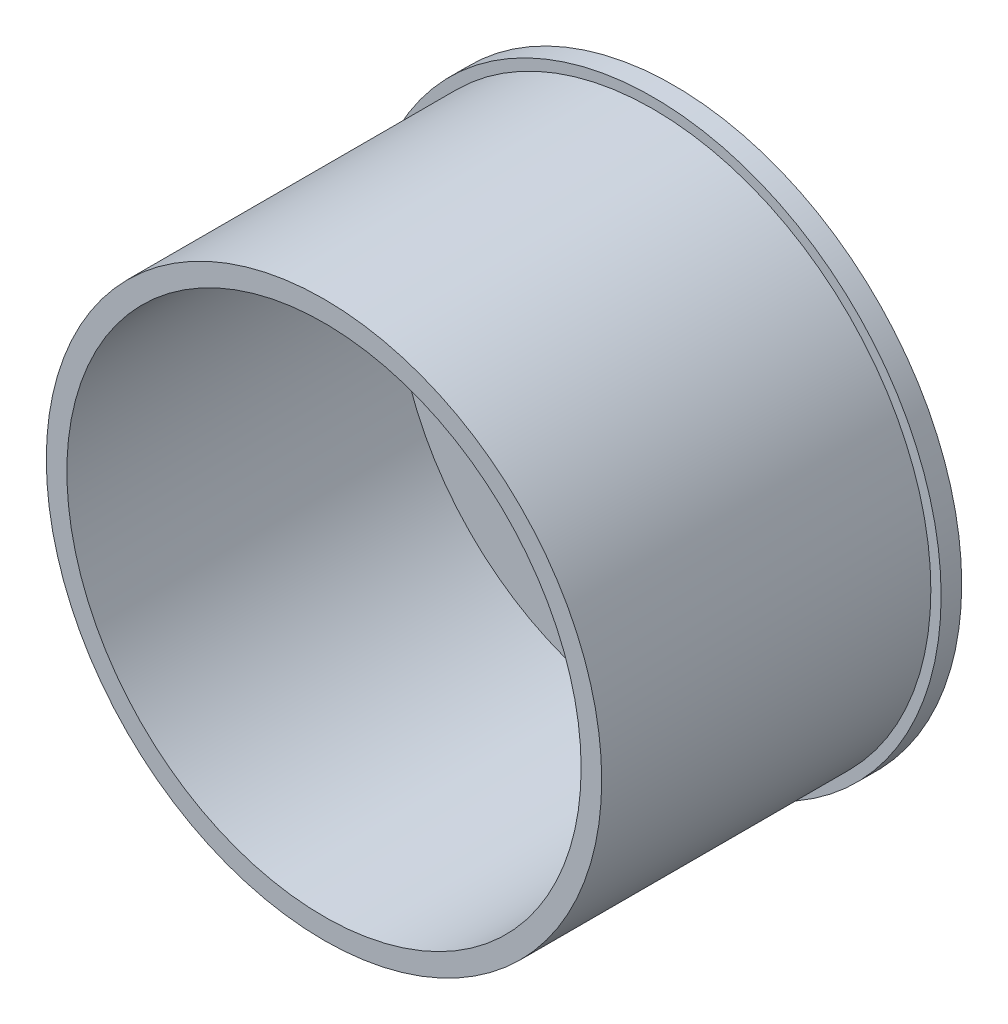
from build123d import *

# Parameters (mm, degrees)
SKETCH1_R           = 88.9
BOSS_EXTRUDE1_DEPTH = 6.35
SKETCH2_R           = 3.302
CUT_EXTRUDE1_DEPTH  = 126.88384527
SKETCH3_R           = 85.725
SKETCH3_R_2         = 79.375
BOSS_EXTRUDE2_DEPTH = 101.6


with BuildPart() as part:
    # Sketch1 → Boss-Extrude1 (new body)
    with BuildSketch(Plane.XY):
        Circle(SKETCH1_R)
    extrude(amount=BOSS_EXTRUDE1_DEPTH)

    # Sketch2 → Cut-Extrude1 (cut, through all)
    with BuildSketch(Plane(origin=(0, 0, 0), x_dir=(-1, 0, 0), z_dir=(0, 0, -1))):
        with Locations((19.05, 0)):
            Circle(SKETCH2_R)
        with BuildLine():
            Line((3.081986422, 3.266652236), (3.265367316, -3.083347764))
            ThreePointArc((3.265367316, -3.083347764), (0.183342684, -6.348676869), (-3.081986422, -3.266652236))
            Line((-3.081986422, -3.266652236), (-3.265367316, 3.083347764))
            ThreePointArc((-3.265367316, 3.083347764), (-0.183342684, 6.348676869), (3.081986422, 3.266652236))
        make_face()
    extrude(amount=-CUT_EXTRUDE1_DEPTH, mode=Mode.SUBTRACT)

    # Sketch3 → Boss-Extrude2 (add)
    with BuildSketch(Plane.XY.offset(6.35)):
        Circle(SKETCH3_R)
        Circle(SKETCH3_R_2, mode=Mode.SUBTRACT)
    extrude(amount=BOSS_EXTRUDE2_DEPTH)


solid = part.part
